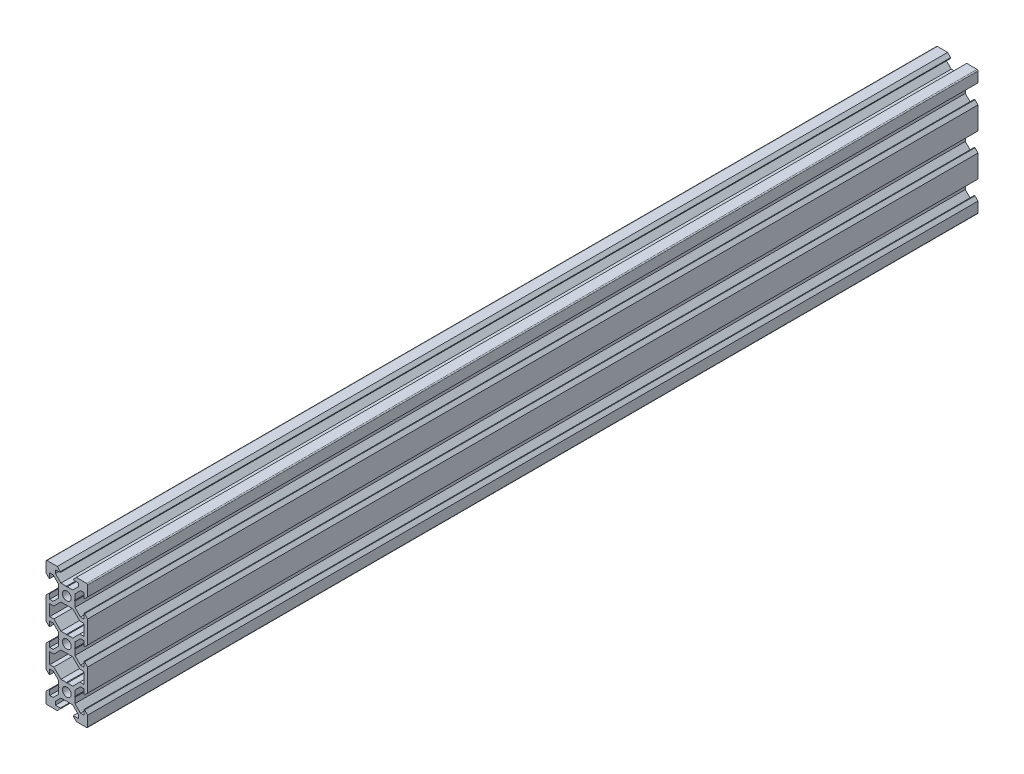
from build123d import *

# Parameters (mm, degrees)
BOSS_EXTRU_1_DEPTH = 427.7


with BuildPart() as part:
    # Esquisse1 → Boss.-Extru.1 (new body)
    with BuildSketch(Plane.XY):
        with BuildLine():
            Line((-9.5, 10), (-4.58, 10))
            Line((-4.58, 10), (-3.125, 8.545))
            Line((-3.125, 8.545), (-3.125, 8.2))
            Line((-3.125, 8.2), (-5.5, 8.2))
            Line((-5.5, 8.2), (-5.5, 6.560660172))
            Line((-5.5, 6.560660172), (-2.839339828, 3.9))
            Line((-2.839339828, 3.9), (-0.21, 3.9))
            Line((-0.21, 3.9), (0, 3.69))
            Line((0, 3.69), (0, 2.1))
            ThreePointArc((0, 2.1), (-2.1, 0), (0, -2.1))
            Line((0, -2.1), (0, -3.69))
            Line((0, -3.69), (-0.21, -3.9))
            Line((-0.21, -3.9), (-2.839339828, -3.9))
            Line((-2.839339828, -3.9), (-6.239339828, -7.3))
            Line((-6.239339828, -7.3), (-8.2, -7.3))
            Line((-8.2, -7.3), (-8.2, -12.7))
            Line((-8.2, -12.7), (-6.239339828, -12.7))
            Line((-6.239339828, -12.7), (-2.839339828, -16.1))
            Line((-2.839339828, -16.1), (-0.21, -16.1))
            Line((-0.21, -16.1), (0, -16.31))
            Line((0, -16.31), (0, -17.9))
            ThreePointArc((0, -17.9), (-2.1, -20), (0, -22.1))
            Line((0, -22.1), (0, -23.69))
            Line((0, -23.69), (-0.21, -23.9))
            Line((-0.21, -23.9), (-2.839339828, -23.9))
            Line((-2.839339828, -23.9), (-6.239339828, -27.3))
            Line((-6.239339828, -27.3), (-8.2, -27.3))
            Line((-8.2, -27.3), (-8.2, -32.7))
            Line((-8.2, -32.7), (-6.239339828, -32.7))
            Line((-6.239339828, -32.7), (-2.839339828, -36.1))
            Line((-2.839339828, -36.1), (-0.21, -36.1))
            Line((-0.21, -36.1), (0, -36.31))
            Line((0, -36.31), (0, -37.9))
            ThreePointArc((0, -37.9), (-2.1, -40), (0, -42.1))
            Line((0, -42.1), (0, -43.69))
            Line((0, -43.69), (-0.21, -43.9))
            Line((-0.21, -43.9), (-2.839339828, -43.9))
            Line((-2.839339828, -43.9), (-5.5, -46.560660172))
            Line((-5.5, -46.560660172), (-5.5, -48.2))
            Line((-5.5, -48.2), (-3.125, -48.2))
            Line((-3.125, -48.2), (-3.125, -48.545))
            Line((-3.125, -48.545), (-4.58, -50))
            Line((-4.58, -50), (-9.5, -50))
            ThreePointArc((-9.5, -50), (-9.853553391, -49.853553391), (-10, -49.5))
            Line((-10, -49.5), (-10, -44.58))
            Line((-10, -44.58), (-8.545, -43.125))
            Line((-8.545, -43.125), (-8.2, -43.125))
            Line((-8.2, -43.125), (-8.2, -45.5))
            Line((-8.2, -45.5), (-6.560660172, -45.5))
            Line((-6.560660172, -45.5), (-3.9, -42.839339828))
            Line((-3.9, -42.839339828), (-3.9, -40.21))
            Line((-3.9, -40.21), (-3.69, -40))
            Line((-3.69, -40), (-3.9, -39.79))
            Line((-3.9, -39.79), (-3.9, -37.160660172))
            Line((-3.9, -37.160660172), (-6.560660172, -34.5))
            Line((-6.560660172, -34.5), (-8.2, -34.5))
            Line((-8.2, -34.5), (-8.2, -36.875))
            Line((-8.2, -36.875), (-8.545, -36.875))
            Line((-8.545, -36.875), (-10, -35.42))
            Line((-10, -35.42), (-10, -24.58))
            Line((-10, -24.58), (-8.545, -23.125))
            Line((-8.545, -23.125), (-8.2, -23.125))
            Line((-8.2, -23.125), (-8.2, -25.5))
            Line((-8.2, -25.5), (-6.560660172, -25.5))
            Line((-6.560660172, -25.5), (-3.9, -22.839339828))
            Line((-3.9, -22.839339828), (-3.9, -20.21))
            Line((-3.9, -20.21), (-3.69, -20))
            Line((-3.69, -20), (-3.9, -19.79))
            Line((-3.9, -19.79), (-3.9, -17.160660172))
            Line((-3.9, -17.160660172), (-6.560660172, -14.5))
            Line((-6.560660172, -14.5), (-8.2, -14.5))
            Line((-8.2, -14.5), (-8.2, -16.875))
            Line((-8.2, -16.875), (-8.545, -16.875))
            Line((-8.545, -16.875), (-10, -15.42))
            Line((-10, -15.42), (-10, -4.58))
            Line((-10, -4.58), (-8.545, -3.125))
            Line((-8.545, -3.125), (-8.2, -3.125))
            Line((-8.2, -3.125), (-8.2, -5.5))
            Line((-8.2, -5.5), (-6.560660172, -5.5))
            Line((-6.560660172, -5.5), (-3.9, -2.839339828))
            Line((-3.9, -2.839339828), (-3.9, -0.21))
            Line((-3.9, -0.21), (-3.69, 0))
            Line((-3.69, 0), (-3.9, 0.21))
            Line((-3.9, 0.21), (-3.9, 2.839339828))
            Line((-3.9, 2.839339828), (-6.560660172, 5.5))
            Line((-6.560660172, 5.5), (-8.2, 5.5))
            Line((-8.2, 5.5), (-8.2, 3.125))
            Line((-8.2, 3.125), (-8.545, 3.125))
            Line((-8.545, 3.125), (-10, 4.58))
            Line((-10, 4.58), (-10, 9.5))
            ThreePointArc((-10, 9.5), (-9.853553391, 9.853553391), (-9.5, 10))
        make_face()
    boss_extru_1 = extrude(amount=BOSS_EXTRU_1_DEPTH)

    # Symétrie1: Boss.-Extru.1 across plane
    add(boss_extru_1.mirror(Plane(origin=(0, 3.69, 427.7), x_dir=(0, 0, 1), z_dir=(-1, 0, 0))))


solid = part.part
